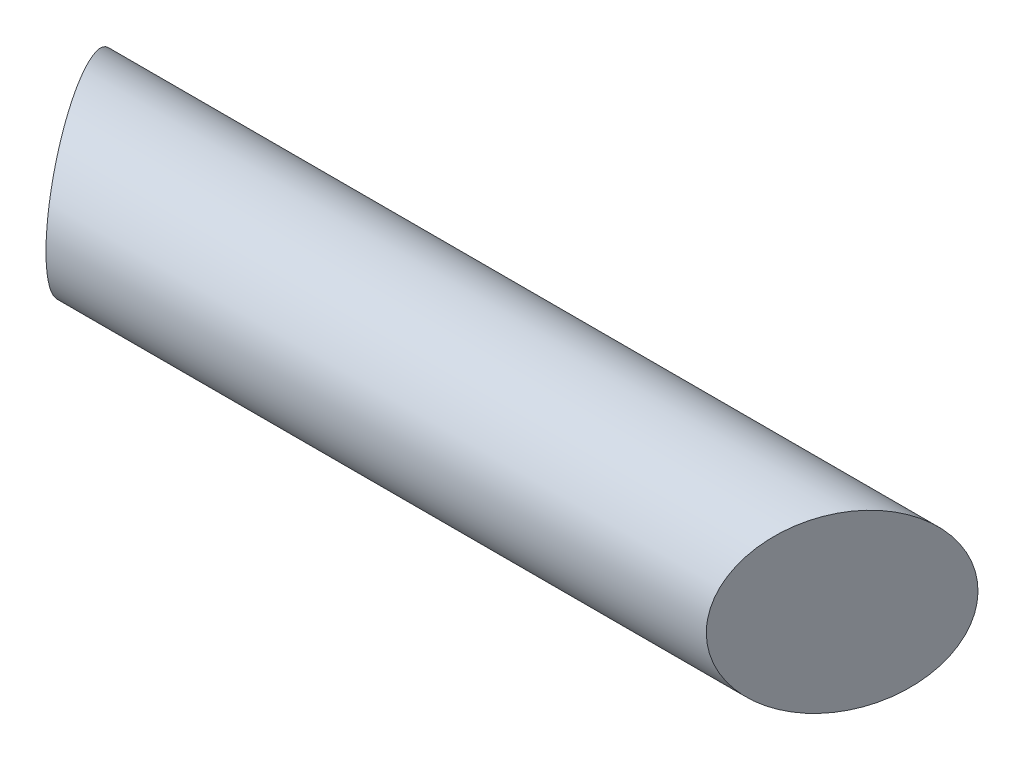
from build123d import *

# Parameters (mm, degrees)
SKETCH_1_R          = 30
EXTRUDE_1_DEPTH     = 150
SKETCH_2_W          = 109.772001157
SKETCH_2_H          = 80.251500104
CUT_EXTRUDE_1_DEPTH = 266.784573674


with BuildPart() as part:
    # 草图1 → 凸台-拉伸1 (new, symmetric)
    with BuildSketch(Plane(origin=(0, 0, 0), x_dir=(0, 0, -1), z_dir=(1, 0, 0))):
        Circle(SKETCH_1_R)
    extrude(amount=EXTRUDE_1_DEPTH, both=True)

    # 草图2 → 切除-拉伸1 (cut, through all)
    with BuildSketch(Plane(origin=(99.240381057, 0, 57.296460718), x_dir=(0, -1, 0), z_dir=(0.866025403784438, 0, 0.500000000000001))):
        with Locations((-4.460929889, 62.152689719)):
            Rectangle(SKETCH_2_W, SKETCH_2_H)
    cut_extrude_1 = extrude(amount=CUT_EXTRUDE_1_DEPTH, mode=Mode.SUBTRACT)

    # 镜向1: 切除-拉伸1 across plane
    add(cut_extrude_1.mirror(Plane(origin=(0, 0, 0), x_dir=(0, 0, 1), z_dir=(1, 0, 0))), mode=Mode.SUBTRACT)


solid = part.part
